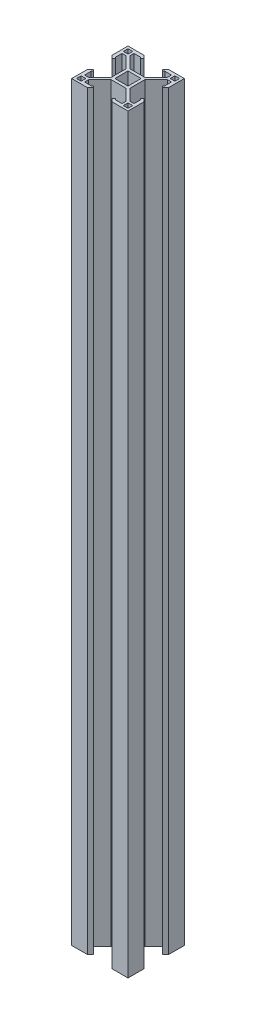
from build123d import *

# Parameters (mm, degrees)
SKETCH_1_W          = 30
SKETCH_1_H          = 30
EXTRUDE_1_DEPTH     = 400
CUT_EXTRUDE_1_DEPTH = 400
SKETCH_3_W          = 7
SKETCH_3_H          = 7
SKETCH_3_W_2        = 2.5
SKETCH_3_H_2        = 2.5
CUT_EXTRUDE_2_DEPTH = 400


with BuildPart() as part:
    # 草图1 → 凸台-拉伸1 (new body)
    with BuildSketch(Plane(origin=(0, 0, 0), x_dir=(1, 0, 0), z_dir=(0, 1, 0))):
        Rectangle(SKETCH_1_W, SKETCH_1_H)
    extrude(amount=EXTRUDE_1_DEPTH)

    # 草图2 → 切除-拉伸1 (cut)
    with BuildSketch(Plane(origin=(0, 400, 0), x_dir=(1, 0, 0), z_dir=(0, 1, 0))):
        Polygon((-4.004617846, 5), (4.004617846, 5), (9.97363434, 10.969016494), (9.97363434, 13.177944766), (6.476155555, 13.177944766), (5.84989743, 12.551686641), (5.001284858, 13.400299213), (6.600985645, 15), (-6.600985645, 15), (-5.001284858, 13.400299213), (-5.84989743, 12.551686641), (-6.476155555, 13.177944766), (-9.97363434, 13.177944766), (-9.97363434, 10.969016494), align=None)
        Polygon((10.969016494, 9.97363434), (5, 4.004617846), (5, -4.004617846), (10.969016494, -9.97363434), (13.177944766, -9.97363434), (13.177944766, -6.476155555), (12.551686641, -5.84989743), (13.400299213, -5.001284858), (15, -6.600985645), (15, 6.600985645), (13.400299213, 5.001284858), (12.551686641, 5.84989743), (13.177944766, 6.476155555), (13.177944766, 9.97363434), align=None)
        Polygon((-5, -4.004617846), (-5, 4.004617846), (-10.969016494, 9.97363434), (-13.177944766, 9.97363434), (-13.177944766, 6.476155555), (-12.551686641, 5.84989743), (-13.400299213, 5.001284858), (-15, 6.600985645), (-15, -6.600985645), (-13.400299213, -5.001284858), (-12.551686641, -5.84989743), (-13.177944766, -6.476155555), (-13.177944766, -9.97363434), (-10.969016494, -9.97363434), align=None)
        Polygon((9.97363434, -10.969016494), (4.004617846, -5), (-4.004617846, -5), (-9.97363434, -10.969016494), (-9.97363434, -13.177944766), (-6.476155555, -13.177944766), (-5.84989743, -12.551686641), (-5.001284858, -13.400299213), (-6.600985645, -15), (6.600985645, -15), (5.001284858, -13.400299213), (5.84989743, -12.551686641), (6.476155555, -13.177944766), (9.97363434, -13.177944766), align=None)
    extrude(amount=-CUT_EXTRUDE_1_DEPTH, mode=Mode.SUBTRACT)

    # 草图3 → 切除-拉伸2 (cut)
    with BuildSketch(Plane(origin=(0, 400, 0), x_dir=(1, 0, 0), z_dir=(0, 1, 0))):
        Rectangle(SKETCH_3_W, SKETCH_3_H)
        with Locations((12.48681717, -12.48681717)):
            Rectangle(SKETCH_3_W_2, SKETCH_3_H_2)
        with Locations((12.48681717, 12.48681717)):
            Rectangle(SKETCH_3_W_2, SKETCH_3_H_2)
        with Locations((-12.48681717, -12.48681717)):
            Rectangle(SKETCH_3_W_2, SKETCH_3_H_2)
        with Locations((-12.48681717, 12.48681717)):
            Rectangle(SKETCH_3_W_2, SKETCH_3_H_2)
    extrude(amount=-CUT_EXTRUDE_2_DEPTH, mode=Mode.SUBTRACT)


solid = part.part
